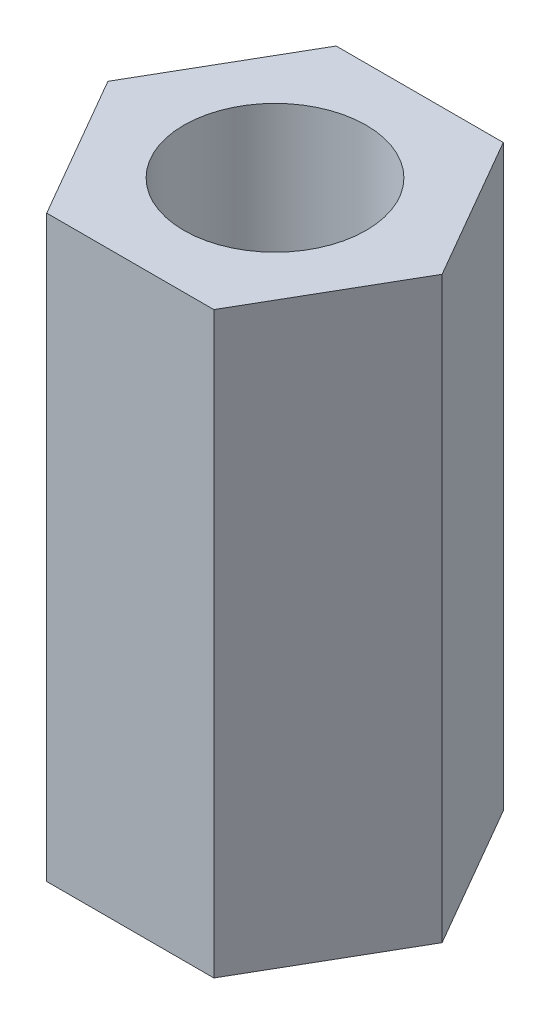
from build123d import *

# Parameters (mm, degrees)
EXTRUDE_1_DEPTH         = 10
HOLE_WIZARD_M36_D       = 3.15
HOLE_WIZARD_M36_DEPTH   = 4
HOLE_WIZARD_M36_TIP     = 0.946355475
HOLE_WIZARD_M36_2_D     = 3.15
HOLE_WIZARD_M36_2_DEPTH = 4
HOLE_WIZARD_M36_2_TIP   = 0.946355475


with BuildPart() as part:
    # Эскиз1 → Бобышка-Вытянуть1 (new body)
    with BuildSketch(Plane(origin=(0, 0, 0), x_dir=(1, 0, 0), z_dir=(0, 1, 0))):
        Polygon((2.886751346, 0), (1.443375673, 2.5), (-1.443375673, 2.5), (-2.886751346, 0), (-1.443375673, -2.5), (1.443375673, -2.5), align=None)
    extrude(amount=EXTRUDE_1_DEPTH)

    # Hole Wizard M36
    with Locations(Plane(origin=(0, 10, 0), x_dir=(1, 0, 0), z_dir=(0, 1, 0))):
        with Locations((0, 0)):
            Hole(HOLE_WIZARD_M36_D / 2, depth=HOLE_WIZARD_M36_DEPTH)
            with Locations((0, 0, -(HOLE_WIZARD_M36_DEPTH + HOLE_WIZARD_M36_TIP / 2))):  # 118° drill point
                Cone(0, HOLE_WIZARD_M36_D / 2, HOLE_WIZARD_M36_TIP, mode=Mode.SUBTRACT)

    # Hole Wizard M36 2
    with Locations(Plane(origin=(0, 0, 0), x_dir=(-1, 0, 0), z_dir=(0, -1, 0))):
        with Locations((0, 0)):
            Hole(HOLE_WIZARD_M36_2_D / 2, depth=HOLE_WIZARD_M36_2_DEPTH)
            with Locations((0, 0, -(HOLE_WIZARD_M36_2_DEPTH + HOLE_WIZARD_M36_2_TIP / 2))):  # 118° drill point
                Cone(0, HOLE_WIZARD_M36_2_D / 2, HOLE_WIZARD_M36_2_TIP, mode=Mode.SUBTRACT)


solid = part.part
